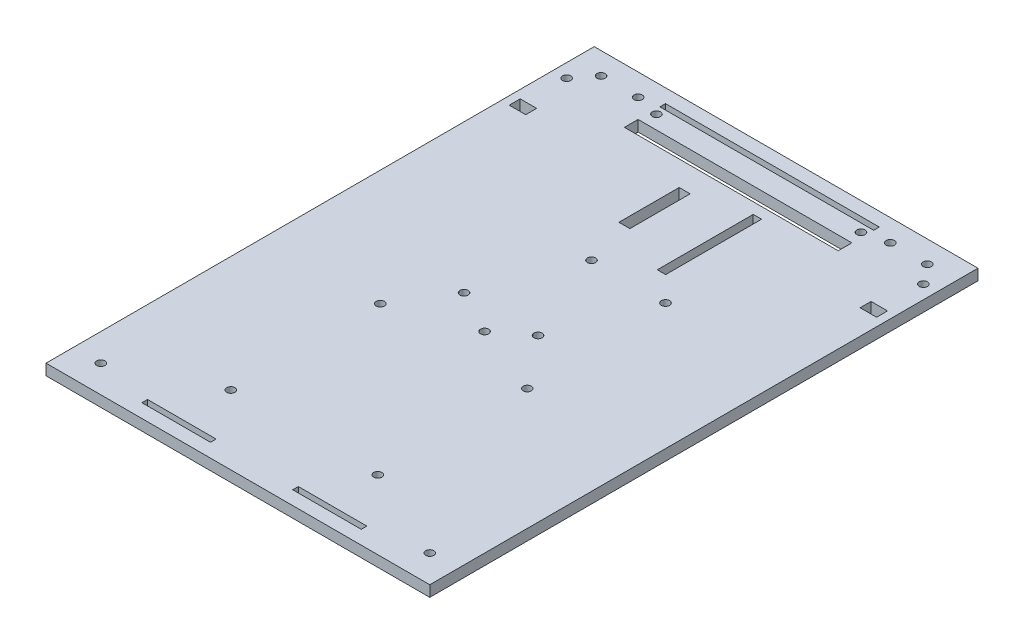
from build123d import *

# Parameters (mm, degrees)
SKETCH1_W           = 140
SKETCH1_H           = 200
BOSS_EXTRUDE1_DEPTH = 4
SKETCH2_W           = 78
SKETCH2_H           = 2.05
SKETCH2_R           = 1.5
SKETCH2_H_2         = 5
CUT_EXTRUDE3_DEPTH  = 123.131077126
SKETCH3_W           = 6
SKETCH3_H           = 4
SKETCH3_R           = 1.5
CUT_EXTRUDE5_DEPTH  = 123.131077126
SKETCH4_R           = 1.5
CUT_EXTRUDE6_DEPTH  = 123.131077126
SKETCH6_W           = 3.05
SKETCH6_H           = 35
SKETCH6_W_2         = 4
SKETCH6_H_2         = 22
CUT_EXTRUDE13_DEPTH = 4
SKETCH7_R           = 1.5
CUT_EXTRUDE15_DEPTH = 123.131077126
SKETCH8_R           = 1.5
SKETCH8_W           = 25
SKETCH8_H           = 2.05
CUT_EXTRUDE16_DEPTH = 4


with BuildPart() as part:
    # Sketch1 → Boss-Extrude1 (new body)
    with BuildSketch(Plane(origin=(0, 0, 0), x_dir=(1, 0, 0), z_dir=(0, 1, 0))):
        Rectangle(SKETCH1_W, SKETCH1_H)
    extrude(amount=BOSS_EXTRUDE1_DEPTH)

    # Sketch2 → Cut-Extrude3 (cut, through all)
    with BuildSketch(Plane(origin=(0, 4, 0), x_dir=(1, 0, 0), z_dir=(0, 1, 0))):
        with Locations((0, 93.975)):
            Rectangle(SKETCH2_W, SKETCH2_H)
        with Locations(Location((-37.3, 90, 0), (0, 0, 270))):
            Circle(SKETCH2_R)
        with Locations(Location((37.3, 90, 0), (0, 0, 270))):
            Circle(SKETCH2_R)
        with Locations((0, 82.5)):
            Rectangle(SKETCH2_W, SKETCH2_H_2)
    extrude(amount=-CUT_EXTRUDE3_DEPTH, mode=Mode.SUBTRACT)

    # Sketch3 → Cut-Extrude5 (cut, through all)
    with BuildSketch(Plane(origin=(0, 4, 0), x_dir=(1, 0, 0), z_dir=(0, 1, 0))):
        with Locations((-64, 68)):
            Rectangle(SKETCH3_W, SKETCH3_H)
        with Locations(Location((65.055984274, 85, 0), (0, 0, 270))):
            Circle(SKETCH3_R)
        with Locations((64, 68)):
            Rectangle(SKETCH3_W, SKETCH3_H)
        with Locations(Location((-65.055984274, 85, 0), (0, 0, 270))):
            Circle(SKETCH3_R)
    extrude(amount=-CUT_EXTRUDE5_DEPTH, mode=Mode.SUBTRACT)

    # Sketch4 → Cut-Extrude6 (cut, through all)
    with BuildSketch(Plane(origin=(0, 4, 0), x_dir=(1, 0, 0), z_dir=(0, 1, 0))):
        with Locations(Location((59.5, 92, 0), (0, 0, 270))):
            Circle(SKETCH4_R)
        with Locations(Location((-59.5, 92, 0), (0, 0, 270))):
            Circle(SKETCH4_R)
        with Locations(Location((-46, 92, 0), (0, 0, 270))):
            Circle(SKETCH4_R)
        with Locations(Location((46, 92, 0), (0, 0, 90))):
            Circle(SKETCH4_R)
    extrude(amount=-CUT_EXTRUDE6_DEPTH, mode=Mode.SUBTRACT)

    # Sketch6 → Cut-Extrude13 (cut)
    with BuildSketch(Plane(origin=(0, 4, 0), x_dir=(1, 0, 0), z_dir=(0, 1, 0))):
        with Locations((13.525, 58.5)):
            Rectangle(SKETCH6_W, SKETCH6_H)
        with Locations((-8, 60)):
            Rectangle(SKETCH6_W_2, SKETCH6_H_2)
    extrude(amount=-CUT_EXTRUDE13_DEPTH, mode=Mode.SUBTRACT)

    # Sketch7 → Cut-Extrude15 (cut, through all)
    with BuildSketch(Plane(origin=(0, 4, 0), x_dir=(1, 0, 0), z_dir=(0, 1, 0))):
        with Locations(Location((25.802064663, -20.235830774, 0), (0, 0, 270))):
            Circle(SKETCH7_R)
        with Locations(Location((-27.802064663, -74.764169226, 0), (0, 0, 270))):
            Circle(SKETCH7_R)
        with Locations(Location((25.802064663, -74.764169226, 0), (0, 0, 270))):
            Circle(SKETCH7_R)
        with Locations(Location((24, 32, 0), (0, 0, 270))):
            Circle(SKETCH7_R)
        with Locations(Location((11, -1.5, 0), (0, 0, 270))):
            Circle(SKETCH7_R)
        with Locations(Location((-16, -1.5, 0), (0, 0, 270))):
            Circle(SKETCH7_R)
        with Locations(Location((-3, 32, 0), (0, 0, 270))):
            Circle(SKETCH7_R)
        with Locations(Location((-27.802064663, -20.235830774, 0), (0, 0, 270))):
            Circle(SKETCH7_R)
    extrude(amount=-CUT_EXTRUDE15_DEPTH, mode=Mode.SUBTRACT)

    # Sketch8 → Cut-Extrude16 (cut)
    with BuildSketch(Plane(origin=(0, 4, 0), x_dir=(1, 0, 0), z_dir=(0, 1, 0))):
        with Locations(Location((0, -10, 0), (0, 0, 270))):
            Circle(SKETCH8_R)
        with Locations(Location((-60, -90, 0), (0, 0, 270))):
            Circle(SKETCH8_R)
        with Locations(Location((60, -90, 0), (0, 0, 90))):
            Circle(SKETCH8_R)
        with Locations((27.5, -93.975)):
            Rectangle(SKETCH8_W, SKETCH8_H)
        with Locations((-27.5, -93.975)):
            Rectangle(SKETCH8_W, SKETCH8_H)
    extrude(amount=-CUT_EXTRUDE16_DEPTH, mode=Mode.SUBTRACT)


solid = part.part
